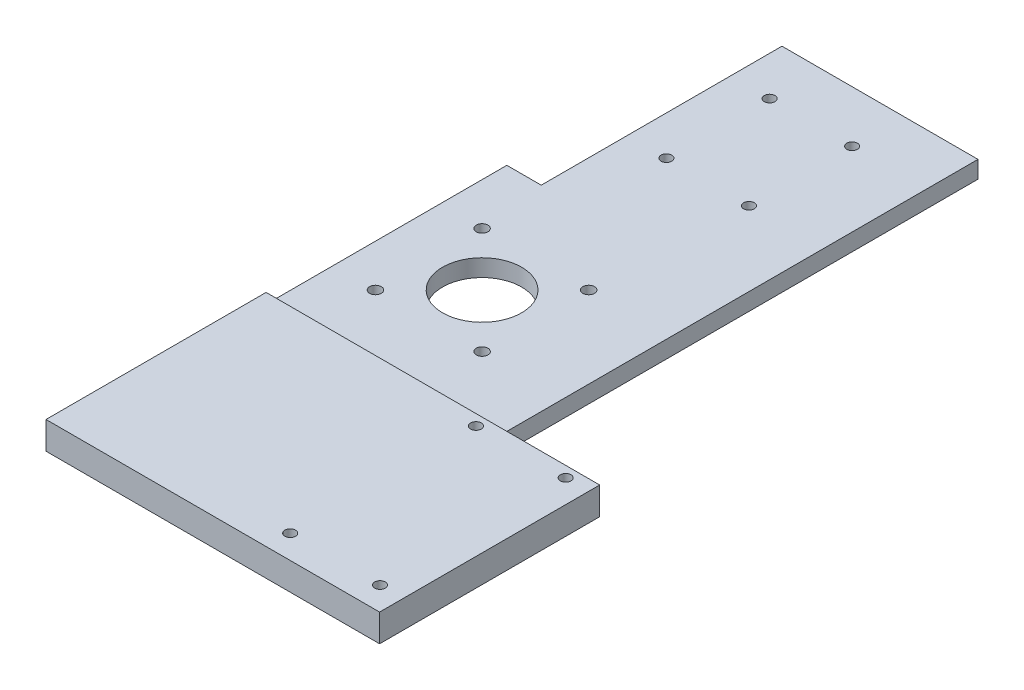
from build123d import *

# Parameters (mm, degrees)
SKETCH_1_W               = 57
SKETCH_1_H               = 140
EXTRUDE_1_DEPTH          = 5
SKETCH_2_R               = 1.55
CUT_EXTRUDE_1_DEPTH      = 10
SKETCH_5_W               = 70
SKETCH_5_H               = 5
EXTRUDE_2_DEPTH          = 10
SKETCH_6_R               = 11.5
SKETCH_6_R_2             = 1.7
CUT_EXTRUDE_2_DEPTH      = 10
EXTRUDE_4_DEPTH          = 3
EXTRUDE_4_DEPTH_BACK     = 5
CUT_EXTRUDE_3_DEPTH      = 222.921157171
CUT_EXTRUDE_3_DEPTH_BACK = 222.921157171
SKETCH_8_R               = 1.55


with BuildPart() as part:
    # 草图1 → 凸台-拉伸1 (new body)
    with BuildSketch(Plane(origin=(0, 0, 0), x_dir=(1, 0, 0), z_dir=(0, 1, 0))):
        with Locations((28.5, -70)):
            Rectangle(SKETCH_1_W, SKETCH_1_H)
    extrude(amount=EXTRUDE_1_DEPTH)

    # 草图2 → 切除-拉伸1 (cut)
    with BuildSketch(Plane.XZ):
        with Locations(Location((11.4, 45, 0), (0, 0, 270))):
            Circle(SKETCH_2_R)
        with Locations(Location((11.4, 15, 0), (0, 0, 270))):
            Circle(SKETCH_2_R)
        with Locations(Location((35.4, 15, 0), (0, 0, 270))):
            Circle(SKETCH_2_R)
        with Locations(Location((35.4, 45, 0), (0, 0, 270))):
            Circle(SKETCH_2_R)
    extrude(amount=-CUT_EXTRUDE_1_DEPTH, mode=Mode.SUBTRACT)

    # 草图5 → 凸台-拉伸2 (add)
    with BuildSketch(Plane.ZY):
        with Locations((105, 2.5)):
            Rectangle(SKETCH_5_W, SKETCH_5_H)
    extrude(amount=EXTRUDE_2_DEPTH)

    # 草图6 → 切除-拉伸2 (cut)
    with BuildSketch(Plane(origin=(0, 5, 0), x_dir=(1, 0, 0), z_dir=(0, 1, 0))):
        with Locations(Location((17.8, -105, 0), (0, 0, 270))):
            Circle(SKETCH_6_R)
        with Locations(Location((33.3, -89.5, 0), (0, 0, 270))):
            Circle(SKETCH_6_R_2)
        with Locations(Location((2.3, -89.5, 0), (0, 0, 270))):
            Circle(SKETCH_6_R_2)
        with Locations(Location((2.3, -120.5, 0), (0, 0, 270))):
            Circle(SKETCH_6_R_2)
        with Locations(Location((33.3, -120.5, 0), (0, 0, 270))):
            Circle(SKETCH_6_R_2)
    extrude(amount=-CUT_EXTRUDE_2_DEPTH, mode=Mode.SUBTRACT)

    # 草图7 → 凸台-拉伸4 (add, two sides: drawn at the far end of the back side and taken through both)
    with BuildSketch(Plane(origin=(0, 5, 0), x_dir=(1, 0, 0), z_dir=(0, 1, 0)).offset(-EXTRUDE_4_DEPTH_BACK)):
        Polygon((87, -140), (57, -140), (-10, -140), (-10, -204), (87, -204), align=None)
    extrude(amount=EXTRUDE_4_DEPTH + EXTRUDE_4_DEPTH_BACK)

    # 草图8 → 切除-拉伸3 (cut, two sides: drawn at the far end of the back side and taken through both)
    with BuildSketch(Plane.XZ.offset(-CUT_EXTRUDE_3_DEPTH_BACK)):
        with Locations(Location((54.15, 197.137921192, 0), (0, 0, 270))):
            Circle(SKETCH_8_R)
        with Locations(Location((80.25, 197.137921192, 0), (0, 0, 270))):
            Circle(SKETCH_8_R)
        with Locations(Location((54.15, 143.137921192, 0), (0, 0, 270))):
            Circle(SKETCH_8_R)
        with Locations(Location((80.25, 143.137921192, 0), (0, 0, 270))):
            Circle(SKETCH_8_R)
    extrude(amount=CUT_EXTRUDE_3_DEPTH + CUT_EXTRUDE_3_DEPTH_BACK, mode=Mode.SUBTRACT)


solid = part.part
